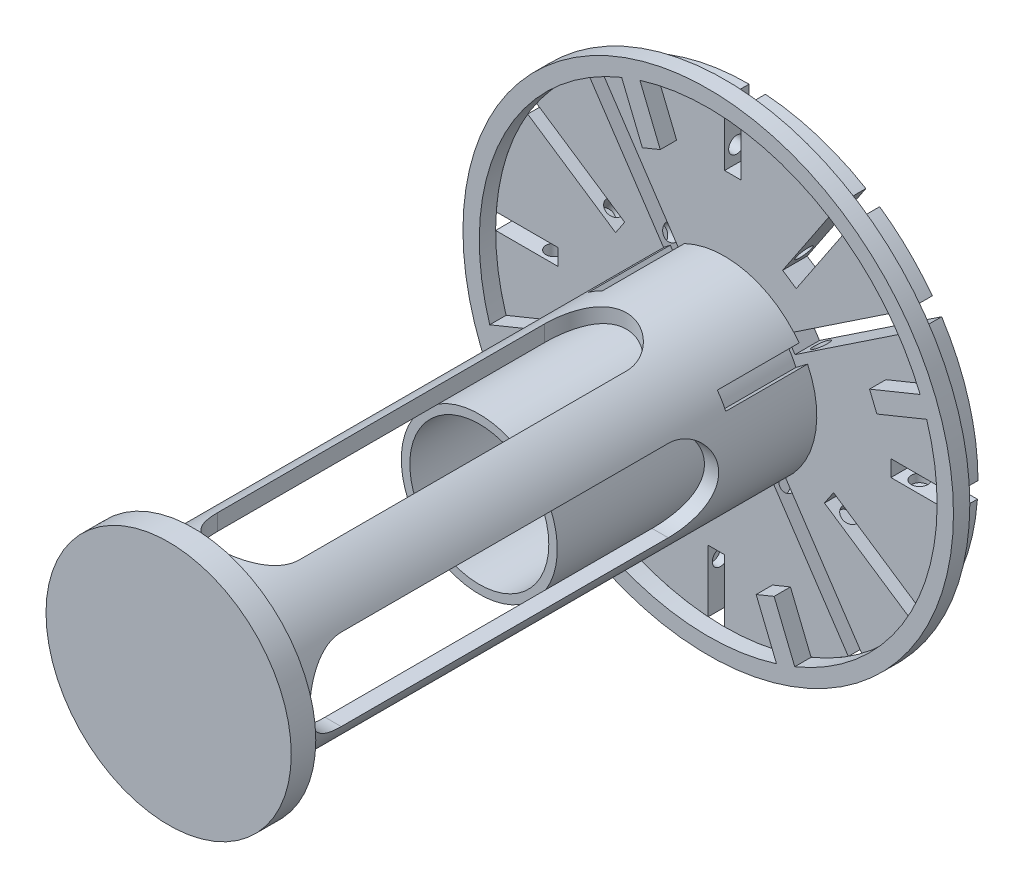
from build123d import *

# Parameters (mm, degrees)
BOSS_EXTRUDE2_DEPTH      = 30
CUT_EXTRUDE4_START       = -10
SKETCH5_R                = 10
CUT_EXTRUDE4_DEPTH       = 50
CUT_EXTRUDE5_START       = -10
SKETCH6_R                = 10
CUT_EXTRUDE5_DEPTH       = 60
CUT_EXTRUDE6_START       = -10
SKETCH7_R                = 10
CUT_EXTRUDE6_DEPTH       = 50
CIRPATTERN2_COUNT        = 4
SKETCH11_R               = 85
CUT_EXTRUDE7_DEPTH       = 426.734659148
SKETCH12_R               = 112.80335558
SKETCH12_R_2             = 95.419126347
BOSS_EXTRUDE4_DEPTH      = 650
SKETCH13_OUTSIDE_W       = 820.19
SKETCH13_OUTSIDE_H       = 820.19
CUT_EXTRUDE8_DEPTH       = 100
CUT_EXTRUDE9_DEPTH       = 120
CUT_EXTRUDE9_DEPTH_BACK  = 120
CUT_EXTRUDE10_DEPTH      = 120
CUT_EXTRUDE10_DEPTH_BACK = 120
SKETCH8_R                = 95.419126347
SKETCH8_R_2              = 85
BOSS_EXTRUDE3_DEPTH      = 300
SKETCH16_R               = 150
BOSS_EXTRUDE5_DEPTH      = 30
SKETCH17_OUTSIDE_W       = 823.988
SKETCH17_OUTSIDE_H       = 823.988
SKETCH17_OUTSIDE_R       = 280
CUT_EXTRUDE11_DEPTH      = 40
BOSS_EXTRUDE9_START      = 30
SKETCH18_R               = 300
BOSS_EXTRUDE9_DEPTH      = 20


with BuildPart() as part:
    # Sketch1 → Boss-Extrude2 (new body)
    with BuildSketch(Plane.XY):
        with BuildLine():
            Line((203.48444248, -20.019434999), (299.623467409, -20.019434999))
            ThreePointArc((299.623467409, -20.019434999), (286.621228061, -89.572716965), (257.705138426, -154.15272177))
            Line((257.705138426, -154.15272177), (133.296389538, -71.025453393))
            Line((133.296389538, -71.025453393), (122.184984877, -87.654845639))
            Line((122.184984877, -87.654845639), (246.870813389, -170.967252702))
            ThreePointArc((246.870813389, -170.967252702), (215.846201221, -208.771208308), (179.096810139, -241.038031435))
            Line((179.096810139, -241.038031435), (68.191030111, -75.055801932))
            Line((68.191030111, -75.055801932), (51.561637865, -86.167206592))
            Line((51.561637865, -86.167206592), (162.652556579, -252.42651572))
            ThreePointArc((162.652556579, -252.42651572), (84.765251268, -288.079593476), (-0.019434999, -300.291524393))
            Line((-0.019434999, -300.291524393), (-0.019434999, -203.48444248))
            Line((-0.019434999, -203.48444248), (-20.019434999, -203.48444248))
            Line((-20.019434999, -203.48444248), (-20.019434999, -299.623467409))
            ThreePointArc((-20.019434999, -299.623467409), (-89.572716965, -286.621228061), (-154.15272177, -257.705138426))
            Line((-154.15272177, -257.705138426), (-71.025453393, -133.296389538))
            Line((-71.025453393, -133.296389538), (-87.654845639, -122.184984877))
            Line((-87.654845639, -122.184984877), (-170.967252702, -246.870813389))
            ThreePointArc((-170.967252702, -246.870813389), (-208.771208308, -215.846201221), (-241.038031435, -179.096810139))
            Line((-241.038031435, -179.096810139), (-75.055801932, -68.191030111))
            Line((-75.055801932, -68.191030111), (-86.167206592, -51.561637865))
            Line((-86.167206592, -51.561637865), (-252.42651572, -162.652556579))
            ThreePointArc((-252.42651572, -162.652556579), (-288.079593476, -84.765251268), (-300.291524393, 0.019434999))
            Line((-300.291524393, 0.019434999), (-203.48444248, 0.019434999))
            Line((-203.48444248, 0.019434999), (-203.48444248, 20.019434999))
            Line((-203.48444248, 20.019434999), (-299.623467409, 20.019434999))
            ThreePointArc((-299.623467409, 20.019434999), (-286.621228061, 89.572716965), (-257.705138426, 154.15272177))
            Line((-257.705138426, 154.15272177), (-133.296389538, 71.025453393))
            Line((-133.296389538, 71.025453393), (-122.184984877, 87.654845639))
            Line((-122.184984877, 87.654845639), (-246.870813389, 170.967252702))
            ThreePointArc((-246.870813389, 170.967252702), (-215.846201221, 208.771208308), (-179.096810139, 241.038031435))
            Line((-179.096810139, 241.038031435), (-68.191030111, 75.055801932))
            Line((-68.191030111, 75.055801932), (-51.561637865, 86.167206592))
            Line((-51.561637865, 86.167206592), (-162.652556579, 252.42651572))
            ThreePointArc((-162.652556579, 252.42651572), (-84.765251268, 288.079593476), (0.019434999, 300.291524393))
            Line((0.019434999, 300.291524393), (0.019434999, 203.48444248))
            Line((0.019434999, 203.48444248), (20.019434999, 203.48444248))
            Line((20.019434999, 203.48444248), (20.019434999, 299.623467409))
            ThreePointArc((20.019434999, 299.623467409), (89.572716965, 286.621228061), (154.15272177, 257.705138426))
            Line((154.15272177, 257.705138426), (71.025453393, 133.296389538))
            Line((71.025453393, 133.296389538), (87.654845639, 122.184984877))
            Line((87.654845639, 122.184984877), (170.967252702, 246.870813389))
            ThreePointArc((170.967252702, 246.870813389), (208.771208308, 215.846201221), (241.038031435, 179.096810139))
            Line((241.038031435, 179.096810139), (75.055801932, 68.191030111))
            Line((75.055801932, 68.191030111), (86.167206592, 51.561637865))
            Line((86.167206592, 51.561637865), (252.42651572, 162.652556579))
            ThreePointArc((252.42651572, 162.652556579), (288.079593476, 84.765251268), (300.291524393, -0.019434999))
            Line((300.291524393, -0.019434999), (203.48444248, -0.019434999))
            Line((203.48444248, -0.019434999), (203.48444248, -20.019434999))
        make_face()
    extrude(amount=BOSS_EXTRUDE2_DEPTH)

    # Sketch5 → Cut-Extrude4 (cut)
    with BuildSketch(Plane(origin=(4.157348062, 2.777851165, 0), x_dir=(0, 0, 1), z_dir=(-0.831469612302545, -0.5555702330196025, 0)).offset(CUT_EXTRUDE4_START)):
        with Locations(Location((15, 120.291525022, 0), (0, 0, 270))):
            Circle(SKETCH5_R)
    cut_extrude4 = extrude(amount=CUT_EXTRUDE4_DEPTH, mode=Mode.SUBTRACT)

    # Sketch6 → Cut-Extrude5 (cut)
    with BuildSketch(Plane.ZY.offset(-20.019434999).offset(CUT_EXTRUDE5_START)):
        with Locations(Location((15, 223.48444248, 0), (0, 0, 270))):
            Circle(SKETCH6_R)
    cut_extrude5 = extrude(amount=CUT_EXTRUDE5_DEPTH, mode=Mode.SUBTRACT)

    # Sketch7 → Cut-Extrude6 (cut)
    with BuildSketch(Plane(origin=(4.157348062, -2.777851165, 0), x_dir=(0, 0, 1), z_dir=(-0.8314696123025459, 0.5555702330196013, 0)).offset(CUT_EXTRUDE6_START)):
        with Locations(Location((15, 170.291525022, 0), (0, 0, 270))):
            Circle(SKETCH7_R)
    cut_extrude6 = extrude(amount=CUT_EXTRUDE6_DEPTH, mode=Mode.SUBTRACT)

    # CirPattern2: Cut-Extrude4, Cut-Extrude5, Cut-Extrude6 ×4 about axis
    cirpattern2_axis = Axis((0, 0, 0), (0, 0, 1))
    add([cut_extrude4.rotate(cirpattern2_axis, i * 360 / CIRPATTERN2_COUNT) for i in range(1, CIRPATTERN2_COUNT)], mode=Mode.SUBTRACT)
    add([cut_extrude5.rotate(cirpattern2_axis, i * 360 / CIRPATTERN2_COUNT) for i in range(1, CIRPATTERN2_COUNT)], mode=Mode.SUBTRACT)
    add([cut_extrude6.rotate(cirpattern2_axis, i * 360 / CIRPATTERN2_COUNT) for i in range(1, CIRPATTERN2_COUNT)], mode=Mode.SUBTRACT)

    # Sketch11 → Cut-Extrude7 (cut, through all)
    with BuildSketch(Plane.XY.offset(30)):
        Circle(SKETCH11_R)
    extrude(amount=-CUT_EXTRUDE7_DEPTH, mode=Mode.SUBTRACT)

    # Sketch12 → Boss-Extrude4 (add)
    with BuildSketch(Plane.XY.offset(30)):
        with Locations(Location((0, 0, 0), (0, 0, 211.209536673))):
            Circle(SKETCH12_R)
        Circle(SKETCH12_R_2, mode=Mode.SUBTRACT)
    extrude(amount=BOSS_EXTRUDE4_DEPTH)

    # Sketch13 outside → Cut-Extrude8 (cut)
    with BuildSketch(Plane.XY.offset(30)):
        Rectangle(SKETCH13_OUTSIDE_W, SKETCH13_OUTSIDE_H)
        with BuildLine():
            Line((-252.42651572, -162.652556579), (-87.302486661, -38.510849065))
            ThreePointArc((-87.302486661, -38.510849065), (-92.107816323, 24.919065896), (-55.977722366, 77.274214791))
            Line((-55.977722366, 77.274214791), (-179.096810139, 241.038031435))
            ThreePointArc((-179.096810139, 241.038031435), (-215.846201221, 208.771208308), (-246.870813389, 170.967252702))
            Line((-246.870813389, 170.967252702), (-122.184984877, 87.654845639))
            Line((-122.184984877, 87.654845639), (-133.296389538, 71.025453393))
            Line((-133.296389538, 71.025453393), (-257.705138426, 154.15272177))
            ThreePointArc((-257.705138426, 154.15272177), (-286.621228061, 89.572716965), (-299.623467409, 20.019434999))
            Line((-299.623467409, 20.019434999), (-203.48444248, 20.019434999))
            Line((-203.48444248, 20.019434999), (-203.48444248, 0.019434999))
            Line((-203.48444248, 0.019434999), (-300.291524393, 0.019434999))
            ThreePointArc((-300.291524393, 0.019434999), (-288.079593476, -84.765251268), (-252.42651572, -162.652556579))
        make_face(mode=Mode.SUBTRACT)
        with BuildLine():
            Line((170.967252702, 246.870813389), (87.654845639, 122.184984877))
            Line((87.654845639, 122.184984877), (71.025453393, 133.296389538))
            Line((71.025453393, 133.296389538), (154.15272177, 257.705138426))
            ThreePointArc((154.15272177, 257.705138426), (89.572716965, 286.621228061), (20.019434999, 299.623467409))
            Line((20.019434999, 299.623467409), (20.019434999, 203.48444248))
            Line((20.019434999, 203.48444248), (0.019434999, 203.48444248))
            Line((0.019434999, 203.48444248), (0.019434999, 300.291524393))
            ThreePointArc((0.019434999, 300.291524393), (-84.765251268, 288.079593476), (-162.652556579, 252.42651572))
            Line((-162.652556579, 252.42651572), (-38.510849065, 87.302486661))
            ThreePointArc((-38.510849065, 87.302486661), (24.919065896, 92.107816323), (77.274214791, 55.977722366))
            Line((77.274214791, 55.977722366), (241.038031435, 179.096810139))
            ThreePointArc((241.038031435, 179.096810139), (208.771208308, 215.846201221), (170.967252702, 246.870813389))
        make_face(mode=Mode.SUBTRACT)
        with BuildLine():
            Line((246.870813389, -170.967252702), (122.184984877, -87.654845639))
            Line((122.184984877, -87.654845639), (133.296389538, -71.025453393))
            Line((133.296389538, -71.025453393), (257.705138426, -154.15272177))
            ThreePointArc((257.705138426, -154.15272177), (286.621228061, -89.572716965), (299.623467409, -20.019434999))
            Line((299.623467409, -20.019434999), (203.48444248, -20.019434999))
            Line((203.48444248, -20.019434999), (203.48444248, -0.019434999))
            Line((203.48444248, -0.019434999), (300.291524393, -0.019434999))
            ThreePointArc((300.291524393, -0.019434999), (288.079593476, 84.765251268), (252.42651572, 162.652556579))
            Line((252.42651572, 162.652556579), (87.302486661, 38.510849065))
            ThreePointArc((87.302486661, 38.510849065), (92.107816323, -24.919065896), (55.977722366, -77.274214791))
            Line((55.977722366, -77.274214791), (179.096810139, -241.038031435))
            ThreePointArc((179.096810139, -241.038031435), (215.846201221, -208.771208308), (246.870813389, -170.967252702))
        make_face(mode=Mode.SUBTRACT)
        with BuildLine():
            Line((-170.967252702, -246.870813389), (-87.654845639, -122.184984877))
            Line((-87.654845639, -122.184984877), (-71.025453393, -133.296389538))
            Line((-71.025453393, -133.296389538), (-154.15272177, -257.705138426))
            ThreePointArc((-154.15272177, -257.705138426), (-89.572716965, -286.621228061), (-20.019434999, -299.623467409))
            Line((-20.019434999, -299.623467409), (-20.019434999, -203.48444248))
            Line((-20.019434999, -203.48444248), (-0.019434999, -203.48444248))
            Line((-0.019434999, -203.48444248), (-0.019434999, -300.291524393))
            ThreePointArc((-0.019434999, -300.291524393), (84.765251268, -288.079593476), (162.652556579, -252.42651572))
            Line((162.652556579, -252.42651572), (38.510849065, -87.302486661))
            ThreePointArc((38.510849065, -87.302486661), (-24.919065896, -92.107816323), (-77.274214791, -55.977722366))
            Line((-77.274214791, -55.977722366), (-241.038031435, -179.096810139))
            ThreePointArc((-241.038031435, -179.096810139), (-208.771208308, -215.846201221), (-170.967252702, -246.870813389))
        make_face(mode=Mode.SUBTRACT)
    extrude(amount=CUT_EXTRUDE8_DEPTH, mode=Mode.SUBTRACT)

    # Sketch14 → Cut-Extrude9 (cut, two sides: drawn at the far end of the back side and taken through both)
    with BuildSketch(Plane(origin=(0, 0, 0), x_dir=(1, 0, 0), z_dir=(0, 1, 0)).offset(-CUT_EXTRUDE9_DEPTH_BACK)):
        with BuildLine():
            Line((-50, -600), (-50, -200))
            ThreePointArc((-50, -200), (0, -150), (50, -200))
            Line((50, -200), (50, -600))
            ThreePointArc((50, -600), (0, -650), (-50, -600))
        make_face()
    extrude(amount=CUT_EXTRUDE9_DEPTH + CUT_EXTRUDE9_DEPTH_BACK, mode=Mode.SUBTRACT)

    # Sketch15 → Cut-Extrude10 (cut, two sides: drawn at the far end of the back side and taken through both)
    with BuildSketch(Plane(origin=(0, 0, 0), x_dir=(0, 0, -1), z_dir=(1, 0, 0)).offset(-CUT_EXTRUDE10_DEPTH_BACK)):
        with BuildLine():
            Line((-600, 50), (-200, 50))
            ThreePointArc((-200, 50), (-150, 0), (-200, -50))
            Line((-200, -50), (-600, -50))
            ThreePointArc((-600, -50), (-650, 0), (-600, 50))
        make_face()
    extrude(amount=CUT_EXTRUDE10_DEPTH + CUT_EXTRUDE10_DEPTH_BACK, mode=Mode.SUBTRACT)

    # Sketch8 → Boss-Extrude3 (add)
    with BuildSketch(Plane.XY.offset(30)):
        with Locations(Location((0, 0, 0), (0, 0, 148.398785541))):
            Circle(SKETCH8_R)
        Circle(SKETCH8_R_2, mode=Mode.SUBTRACT)
    extrude(amount=BOSS_EXTRUDE3_DEPTH)

    # Sketch16 → Boss-Extrude5 (add)
    with BuildSketch(Plane.XY.offset(680)):
        Circle(SKETCH16_R)
    extrude(amount=BOSS_EXTRUDE5_DEPTH)

    # Sketch17 outside → Cut-Extrude11 (cut)
    with BuildSketch(Plane.XY.offset(30)):
        Rectangle(SKETCH17_OUTSIDE_W, SKETCH17_OUTSIDE_H)
        Circle(SKETCH17_OUTSIDE_R, mode=Mode.SUBTRACT)
    extrude(amount=-CUT_EXTRUDE11_DEPTH, mode=Mode.SUBTRACT)


with BuildPart() as body_2:
    # Sketch18 → Boss-Extrude9 (new body)
    with BuildSketch(Plane.XY.offset(BOSS_EXTRUDE9_START)):
        Circle(SKETCH18_R)
        with BuildLine():
            Line((-105.854901066, 259.219482139), (-80.587189037, 197.343431422))
            Line((-80.587189037, 197.343431422), (-58.658881158, 206.298078048))
            Line((-58.658881158, 206.298078048), (-83.547160281, 267.244966293))
            ThreePointArc((-83.547160281, 267.244966293), (119.276483245, 253.324141259), (259.219482139, 105.854901066))
            Line((259.219482139, 105.854901066), (197.343431422, 80.587189037))
            Line((197.343431422, 80.587189037), (206.298078048, 58.658881158))
            Line((206.298078048, 58.658881158), (267.244966293, 83.547160281))
            ThreePointArc((267.244966293, 83.547160281), (253.324141259, -119.276483245), (105.854901066, -259.219482139))
            Line((105.854901066, -259.219482139), (80.587189037, -197.343431422))
            Line((80.587189037, -197.343431422), (58.658881158, -206.298078048))
            Line((58.658881158, -206.298078048), (83.547160281, -267.244966293))
            ThreePointArc((83.547160281, -267.244966293), (-119.276483245, -253.324141259), (-259.219482139, -105.854901066))
            Line((-259.219482139, -105.854901066), (-197.343431422, -80.587189037))
            Line((-197.343431422, -80.587189037), (-206.298078048, -58.658881158))
            Line((-206.298078048, -58.658881158), (-267.244966293, -83.547160281))
            ThreePointArc((-267.244966293, -83.547160281), (-253.324141259, 119.276483245), (-105.854901066, 259.219482139))
        make_face(mode=Mode.SUBTRACT)
    extrude(amount=BOSS_EXTRUDE9_DEPTH)


solid = Compound([part.part, body_2.part])
